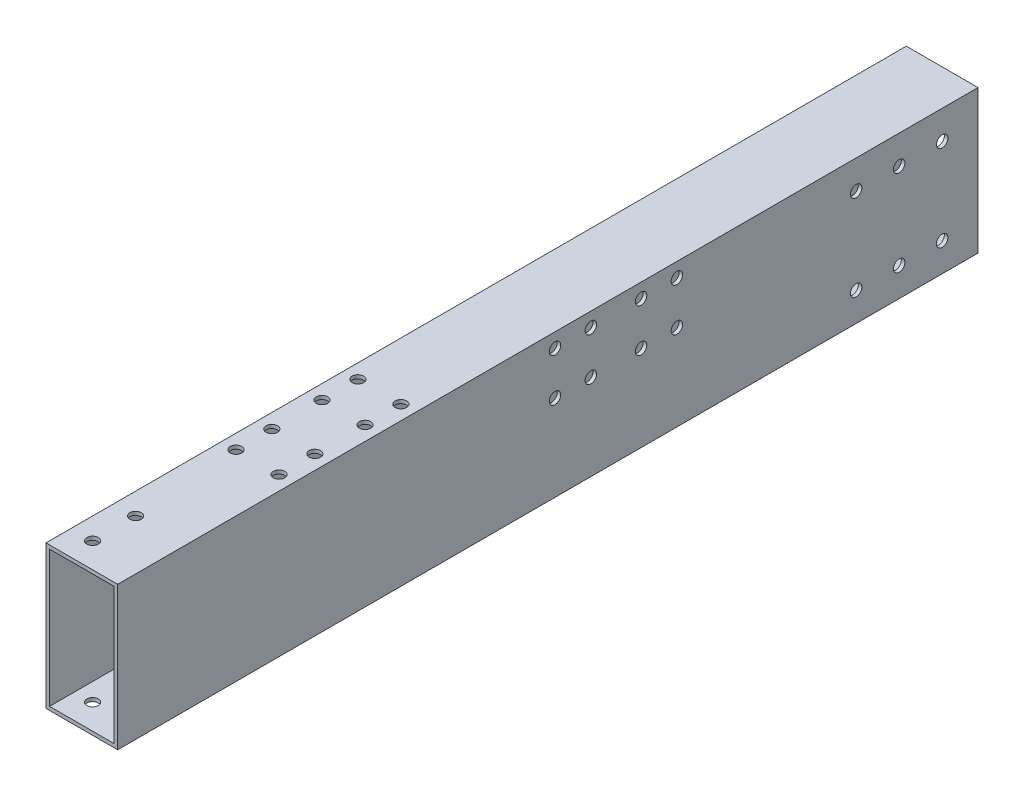
from build123d import *

# Parameters (mm, degrees)
SKETCH_1_W          = 20
SKETCH_1_H          = 40
SKETCH_1_W_2        = 18
SKETCH_1_H_2        = 38
EXTRUDE_1_DEPTH     = 240
SKETCH_2_R          = 1.6
CUT_EXTRUDE_1_DEPTH = 280
SKETCH_3_R          = 1.6
CUT_EXTRUDE_2_DEPTH = 280


with BuildPart() as part:
    # 草图1 → 凸台-拉伸1 (new body)
    with BuildSketch(Plane.XY):
        with Locations((10, 20)):
            Rectangle(SKETCH_1_W, SKETCH_1_H)
        with Locations((10, 20)):
            Rectangle(SKETCH_1_W_2, SKETCH_1_H_2, mode=Mode.SUBTRACT)
    extrude(amount=EXTRUDE_1_DEPTH)

    # 草图2 → 切除-拉伸1 (cut)
    with BuildSketch(Plane(origin=(0, 40, 0), x_dir=(1, 0, 0), z_dir=(0, 1, 0))):
        with Locations(Location((6, -221, 0), (0, 0, 270))):
            Circle(SKETCH_2_R)
        with Locations(Location((6, -233, 0), (0, 0, 270))):
            Circle(SKETCH_2_R)
        with Locations((34, -221)):
            Circle(SKETCH_2_R)
        with Locations((34, -233)):
            Circle(SKETCH_2_R)
        with Locations(Location((4, -191, 0), (0, 0, 270))):
            Circle(SKETCH_2_R)
        with Locations(Location((4, -181, 0), (0, 0, 270))):
            Circle(SKETCH_2_R)
        with Locations(Location((16, -167, 0), (0, 0, 270))):
            Circle(SKETCH_2_R)
        with Locations(Location((16, -157, 0), (0, 0, 270))):
            Circle(SKETCH_2_R)
        with Locations(Location((4, -167, 0), (0, 0, 270))):
            Circle(SKETCH_2_R)
        with Locations(Location((4, -157, 0), (0, 0, 270))):
            Circle(SKETCH_2_R)
        with Locations(Location((16, -191, 0), (0, 0, 270))):
            Circle(SKETCH_2_R)
        with Locations(Location((16, -181, 0), (0, 0, 270))):
            Circle(SKETCH_2_R)
    extrude(amount=-CUT_EXTRUDE_1_DEPTH, mode=Mode.SUBTRACT)

    # 草图3 → 切除-拉伸2 (cut)
    with BuildSketch(Plane.ZY):
        with Locations((10, 8)):
            Circle(SKETCH_3_R)
        with Locations((34, 8)):
            Circle(SKETCH_3_R)
        with Locations((10, 32)):
            Circle(SKETCH_3_R)
        with Locations((34, 32)):
            Circle(SKETCH_3_R)
        with Locations((22, 32)):
            Circle(SKETCH_3_R)
        with Locations((22, 8)):
            Circle(SKETCH_3_R)
        with Locations((84, 24)):
            Circle(SKETCH_3_R)
        with Locations((94, 24)):
            Circle(SKETCH_3_R)
        with Locations((108, 36)):
            Circle(SKETCH_3_R)
        with Locations((118, 36)):
            Circle(SKETCH_3_R)
        with Locations((108, 24)):
            Circle(SKETCH_3_R)
        with Locations((118, 24)):
            Circle(SKETCH_3_R)
        with Locations((84, 36)):
            Circle(SKETCH_3_R)
        with Locations((94, 36)):
            Circle(SKETCH_3_R)
    extrude(amount=-CUT_EXTRUDE_2_DEPTH, mode=Mode.SUBTRACT)


solid = part.part
